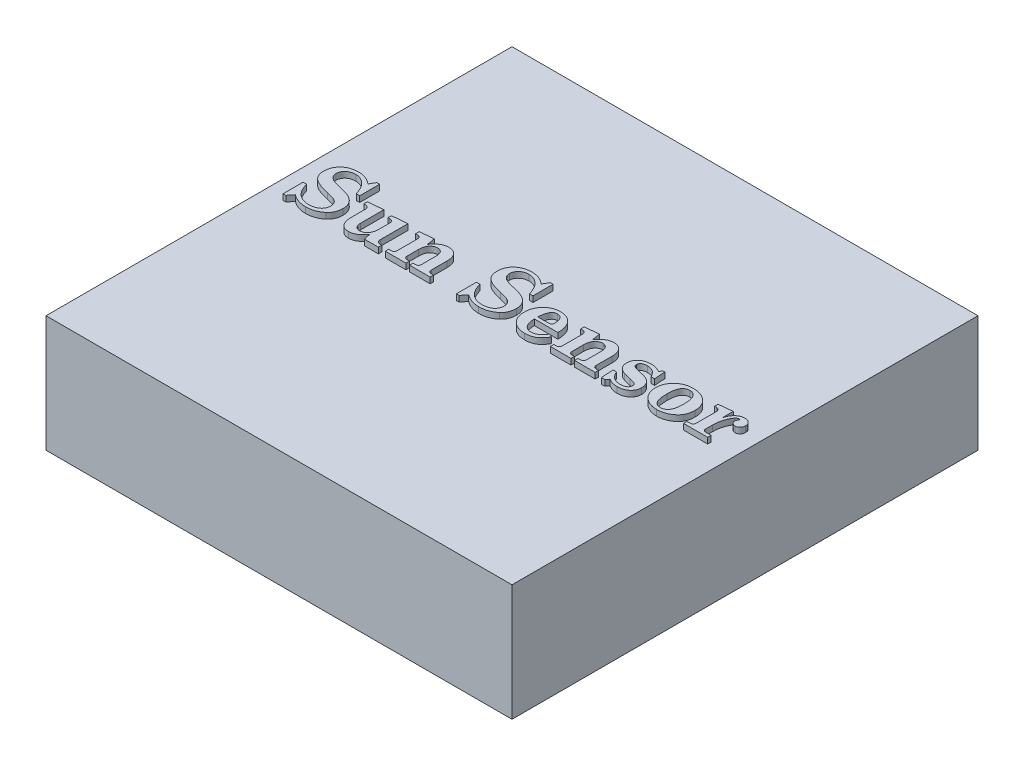
from build123d import *

# Parameters (mm, degrees)
SKETCH1_W           = 80
SKETCH1_H           = 80
BOSS_EXTRUDE1_DEPTH = 20
BOSS_EXTRUDE2_DEPTH = 1


with BuildPart() as part:
    # Sketch1 → Boss-Extrude1 (new body)
    with BuildSketch(Plane(origin=(0, 0, 0), x_dir=(1, 0, 0), z_dir=(0, 1, 0))):
        Rectangle(SKETCH1_W, SKETCH1_H)
    extrude(amount=BOSS_EXTRUDE1_DEPTH)

    # Sketch3 → Boss-Extrude2 (add)
    # profile 1 of 9: a face of its own
    with BuildSketch(Plane(origin=(0, 20, 0), x_dir=(1, 0, 0), z_dir=(0, 1, 0))):
        with BuildLine():
            Line((-30.955542102, 6.225516857), (-30.386931162, 7.20530574))
            Line((-30.386931162, 7.20530574), (-29.91278002, 7.20530574))
            Line((-29.91278002, 7.20530574), (-29.91278002, 3.767709961))
            Line((-29.91278002, 3.767709961), (-30.505468948, 3.767709961))
            add(Edge.make_bspline(
                [(-30.505468948, 3.767709961), (-30.541427462, 3.882899969), (-30.611797897, 4.108325604), (-30.733110836, 4.432480108), (-30.869336675, 4.732746913), (-31.013077712, 5.011928147), (-31.168961697, 5.268197387), (-31.335451768, 5.503299832), (-31.51568351, 5.714141414), (-31.704580887, 5.904430374), (-31.902972008, 6.069974078), (-32.10471366, 6.216520562), (-32.314103258, 6.336853007), (-32.527306033, 6.438047516), (-32.746457041, 6.515880869), (-32.970294798, 6.571807351), (-33.199273758, 6.606339152), (-33.353960964, 6.610514075), (-33.431870526, 6.612616812)],
                knots=[0, 0, 0, 0, 1.319776028, 2.582787814, 3.782699321, 4.924401408, 6.015368239, 7.061002147, 8.071798736, 9.045905284, 9.99008261, 10.895199989, 11.76966991, 12.627609111, 13.473423528, 14.308713002, 15.148168534, 16, 16, 16, 16], degree=3))
            add(Edge.make_bspline(
                [(-33.431870526, 6.612616812), (-33.497352129, 6.6110295), (-33.625550889, 6.607921886), (-33.813626016, 6.588412283), (-33.991790548, 6.550513912), (-34.160904908, 6.500506791), (-34.321993181, 6.438288533), (-34.471710654, 6.357356022), (-34.61395279, 6.264901994), (-34.743816427, 6.157574155), (-34.86286552, 6.042085866), (-34.963947306, 5.917086566), (-35.052710702, 5.789317812), (-35.123438875, 5.654112095), (-35.17968321, 5.513402996), (-35.217581805, 5.366408517), (-35.243542166, 5.214542569), (-35.245820406, 5.111251082), (-35.246980366, 5.058660531)],
                knots=[0, 0, 0, 0, 1.179059863, 2.308343204, 3.398322431, 4.453397569, 5.481306975, 6.500646799, 7.511833234, 8.530869999, 9.529082904, 10.492593709, 11.420571073, 12.32549536, 13.233690467, 14.142293599, 15.054154357, 16, 16, 16, 16], degree=3))
            add(Edge.make_bspline(
                [(-35.246980366, 5.058660531), (-35.244181016, 4.996790785), (-35.238648849, 4.874521773), (-35.203861845, 4.694800144), (-35.13993748, 4.524803357), (-35.058412698, 4.359183816), (-34.942366996, 4.206986615), (-34.800484778, 4.063642213), (-34.624827375, 3.938040398), (-34.460009862, 3.837581799), (-34.304672168, 3.766496014), (-34.166507743, 3.708573476), (-34.008117601, 3.649214777), (-33.828043125, 3.593413487), (-33.629368093, 3.533689644), (-33.410409687, 3.472195387), (-33.170629301, 3.411758347), (-33.003471622, 3.372923632), (-32.91697202, 3.352827712)],
                knots=[0, 0, 0, 0, 0.942679781, 1.862954546, 2.77322944, 3.702683276, 4.663757636, 5.6744788, 6.763451916, 7.943992375, 8.608674477, 9.363148904, 10.226045617, 11.183663279, 12.233902495, 13.386125419, 14.647390233, 16, 16, 16, 16], degree=3))
            add(Edge.make_bspline(
                [(-32.91697202, 3.352827712), (-32.815673968, 3.328951209), (-32.620225976, 3.282883051), (-32.339099954, 3.213196226), (-32.080987324, 3.143126234), (-31.84460814, 3.081003928), (-31.632578696, 3.01398997), (-31.442311881, 2.95444346), (-31.274775786, 2.895387051), (-31.172107941, 2.853715546), (-31.124088015, 2.834224901)],
                knots=[0, 0, 0, 0, 1.337017139, 2.579687437, 3.72053628, 4.773019566, 5.718849226, 6.576684044, 7.334284974, 8, 8, 8, 8], degree=3))
            add(Edge.make_bspline(
                [(-31.124088015, 2.834224901), (-31.055889123, 2.803355148), (-30.922275957, 2.742876081), (-30.730148487, 2.643235987), (-30.55311441, 2.533187707), (-30.386491408, 2.418891681), (-30.235473031, 2.294817559), (-30.096526901, 2.163889295), (-29.971271811, 2.025916787), (-29.859080457, 1.880382005), (-29.760494405, 1.727097714), (-29.672945613, 1.566751427), (-29.601053464, 1.397043555), (-29.541166838, 1.220062956), (-29.495442887, 1.034743575), (-29.461511452, 0.841752807), (-29.443699319, 0.640374267), (-29.440342305, 0.503629538), (-29.438628878, 0.433834745)],
                knots=[0, 0, 0, 0, 1.14653782, 2.246261516, 3.311791084, 4.337468781, 5.33879562, 6.302025459, 7.259342286, 8.189897906, 9.113170072, 10.048231112, 10.984438999, 11.93236922, 12.907088183, 13.905150231, 14.930784337, 16, 16, 16, 16], degree=3))
            add(Edge.make_bspline(
                [(-29.438628878, 0.433834745), (-29.440638835, 0.329943835), (-29.444569206, 0.126790333), (-29.489325625, -0.168948049), (-29.556987216, -0.449218915), (-29.653581314, -0.713445908), (-29.778184446, -0.961710573), (-29.931641059, -1.191953932), (-30.110147861, -1.408650092), (-30.249442218, -1.535396533), (-30.320253658, -1.599829136)],
                knots=[0, 0, 0, 0, 1.087616632, 2.126780161, 3.126105745, 4.104252425, 5.067529187, 6.029110535, 6.998082019, 8, 8, 8, 8], degree=3))
            add(Edge.make_bspline(
                [(-30.320253658, -1.599829136), (-30.410217236, -1.67336125), (-30.588832182, -1.819352937), (-30.880732062, -2.003716905), (-31.185316279, -2.163422983), (-31.508312817, -2.290014873), (-31.8457695, -2.393991534), (-32.201089433, -2.462167002), (-32.570737666, -2.506348708), (-32.822380468, -2.511946738), (-32.950310773, -2.514792668)],
                knots=[0, 0, 0, 0, 0.978964361, 1.943649534, 2.905309704, 3.874955019, 4.86478111, 5.878630743, 6.921537144, 8, 8, 8, 8], degree=3))
            add(Edge.make_bspline(
                [(-32.950310773, -2.514792668), (-33.069606925, -2.511921178), (-33.305874615, -2.506234151), (-33.656302804, -2.461398751), (-33.999797568, -2.393175156), (-34.333734425, -2.288469071), (-34.661467499, -2.162217846), (-34.978933191, -2.00180835), (-35.291847975, -1.818547111), (-35.488379653, -1.673292405), (-35.587776499, -1.599829136)],
                knots=[0, 0, 0, 0, 1.006582518, 1.993550691, 2.977708554, 3.958494488, 4.943590011, 5.938682306, 6.957478621, 8, 8, 8, 8], degree=3))
            Line((-35.587776499, -1.599829136), (-36.313820435, -2.514792668))
            Line((-36.313820435, -2.514792668), (-36.787971577, -2.514792668))
            Line((-36.787971577, -2.514792668), (-36.787971577, 0.92280311))
            Line((-36.787971577, 0.92280311), (-36.195282649, 0.92280311))
            add(Edge.make_bspline(
                [(-36.195282649, 0.92280311), (-36.161419164, 0.807541836), (-36.095283388, 0.582435239), (-35.976097986, 0.25970609), (-35.844993321, -0.041199354), (-35.700556571, -0.319909126), (-35.543045579, -0.576445439), (-35.3725432, -0.810974581), (-35.188609925, -1.022358662), (-34.993591456, -1.213682925), (-34.783540141, -1.379842589), (-34.561798264, -1.526401955), (-34.326013289, -1.647996524), (-34.078191524, -1.74890283), (-33.817639297, -1.826718512), (-33.544269253, -1.881877333), (-33.258018129, -1.916041744), (-33.062771432, -1.920057404), (-32.963275843, -1.922103741)],
                knots=[0, 0, 0, 0, 1.231685107, 2.405495193, 3.525354633, 4.595781342, 5.62194636, 6.609716111, 7.565664147, 8.492486262, 9.407117973, 10.307971796, 11.214149599, 12.122977695, 13.04839309, 13.998283572, 14.979947126, 16, 16, 16, 16], degree=3))
            add(Edge.make_bspline(
                [(-32.963275843, -1.922103741), (-32.882343152, -1.920779079), (-32.725095007, -1.918205327), (-32.496074338, -1.895482366), (-32.281085018, -1.859149164), (-32.079603019, -1.807290851), (-31.892595861, -1.740532293), (-31.718012478, -1.661061643), (-31.558414801, -1.56454525), (-31.413965122, -1.452935302), (-31.284740631, -1.330937843), (-31.170716467, -1.201454423), (-31.075589419, -1.063084772), (-30.997889649, -0.918191611), (-30.934904165, -0.766660752), (-30.893690848, -0.606943574), (-30.866371394, -0.44007754), (-30.862870912, -0.326278189), (-30.861082304, -0.268131203)],
                knots=[0, 0, 0, 0, 1.293831505, 2.513849511, 3.675894659, 4.777316931, 5.835830258, 6.847310371, 7.83943162, 8.810906231, 9.760670304, 10.677276707, 11.564492177, 12.439039997, 13.302485202, 14.181312827, 15.070722477, 16, 16, 16, 16], degree=3))
            add(Edge.make_bspline(
                [(-30.861082304, -0.268131203), (-30.863697615, -0.188870171), (-30.868768489, -0.035189566), (-30.914254407, 0.184426565), (-30.986182234, 0.385532591), (-31.091976125, 0.565511693), (-31.228493057, 0.728158625), (-31.397386554, 0.872484125), (-31.597761357, 1.002129459), (-31.747824532, 1.069298305), (-31.826053964, 1.104314094)],
                knots=[0, 0, 0, 0, 1.057749482, 2.050889025, 2.982426971, 3.899058759, 4.824111711, 5.806369846, 6.856438707, 8, 8, 8, 8], degree=3))
            add(Edge.make_bspline(
                [(-31.826053964, 1.104314094), (-31.852538353, 1.114367966), (-31.913705812, 1.13758805), (-32.018767045, 1.172071474), (-32.149064762, 1.211010569), (-32.304769823, 1.25329621), (-32.485753363, 1.299321527), (-32.691653214, 1.348687991), (-32.921576736, 1.40515583), (-33.083610084, 1.442258062), (-33.168864815, 1.461779604)],
                knots=[0, 0, 0, 0, 0.488899624, 1.129146184, 1.907908525, 2.835958675, 3.913689345, 5.130992951, 6.490456269, 8, 8, 8, 8], degree=3))
            add(Edge.make_bspline(
                [(-33.168864815, 1.461779604), (-33.285015923, 1.489841634), (-33.510336444, 1.544278923), (-33.836678386, 1.628995548), (-34.139746651, 1.715985122), (-34.419563131, 1.80283328), (-34.67628503, 1.889450265), (-34.909014566, 1.978240612), (-35.11963475, 2.06667012), (-35.363552213, 2.184993554), (-35.634860832, 2.342058465), (-35.918250858, 2.55449216), (-36.155190541, 2.788670789), (-36.349407151, 3.043185931), (-36.492362826, 3.327365296), (-36.597450283, 3.636160542), (-36.658542837, 3.97461048), (-36.665725876, 4.209508878), (-36.669433791, 4.330764442)],
                knots=[0, 0, 0, 0, 1.15334182, 2.237357742, 3.253976117, 4.196366833, 5.065095743, 5.868568384, 6.600168899, 7.269119258, 8.484304555, 9.620101968, 10.677738208, 11.690769999, 12.695512897, 13.733835216, 14.830195993, 16, 16, 16, 16], degree=3))
            add(Edge.make_bspline(
                [(-36.669433791, 4.330764442), (-36.667278271, 4.43464099), (-36.663065054, 4.637679849), (-36.620221597, 4.934580954), (-36.554963259, 5.217437555), (-36.459390719, 5.485293642), (-36.33899815, 5.739324466), (-36.189393835, 5.977136465), (-36.014318607, 6.201132569), (-35.812750035, 6.407478333), (-35.588915114, 6.594580734), (-35.344842086, 6.758241577), (-35.082629815, 6.897929534), (-34.801304876, 7.011222035), (-34.501888403, 7.097365466), (-34.18484353, 7.160942374), (-33.849471714, 7.197667647), (-33.619644233, 7.202723366), (-33.502252336, 7.20530574)],
                knots=[0, 0, 0, 0, 1.035008797, 2.023045706, 2.98455394, 3.924884624, 4.852721898, 5.781844619, 6.720138272, 7.682138956, 8.652316847, 9.623724157, 10.606782453, 11.609229013, 12.641617044, 13.708762662, 14.829675657, 16, 16, 16, 16], degree=3))
            add(Edge.make_bspline(
                [(-33.502252336, 7.20530574), (-33.387255249, 7.202665108), (-33.158782425, 7.197418778), (-32.820972179, 7.14900843), (-32.490357713, 7.073233076), (-32.167202197, 6.965331519), (-31.851507403, 6.825412532), (-31.543377399, 6.655722196), (-31.241072191, 6.457786105), (-31.051789235, 6.303810704), (-30.955542102, 6.225516857)],
                knots=[0, 0, 0, 0, 0.989559008, 1.966026685, 2.931744359, 3.906633899, 4.894263871, 5.900484555, 6.93243245, 8, 8, 8, 8], degree=3))
        make_face()
    # profile 2 of 9: a face of its own
    with BuildSketch(Plane(origin=(0, 20, 0), x_dir=(1, 0, 0), z_dir=(0, 1, 0))):
        with BuildLine():
            Line((-28.371788809, 3.53063439), (-25.763957529, 3.767709961))
            Line((-25.763957529, 3.767709961), (-25.763957529, -0.240348909))
            add(Edge.make_bspline(
                [(-25.763957529, -0.240348909), (-25.760645389, -0.328947922), (-25.754323334, -0.498061501), (-25.69992334, -0.737782745), (-25.610016197, -0.949640574), (-25.479430345, -1.126415616), (-25.324363284, -1.272749901), (-25.139968964, -1.372613601), (-24.93606822, -1.437922365), (-24.792110838, -1.444528393), (-24.717491142, -1.447952599)],
                knots=[0, 0, 0, 0, 1.18137524, 2.254952836, 3.262442219, 4.230077412, 5.169180991, 6.084107018, 7.006905032, 8, 8, 8, 8], degree=3))
            add(Edge.make_bspline(
                [(-24.717491142, -1.447952599), (-24.664264697, -1.446942131), (-24.559608693, -1.444955308), (-24.4071018, -1.416992728), (-24.261811001, -1.377422214), (-24.125418382, -1.319425798), (-23.998128365, -1.244268259), (-23.879010982, -1.152595894), (-23.767238979, -1.044929217), (-23.666872141, -0.920396476), (-23.574809191, -0.786819791), (-23.495327199, -0.645003529), (-23.425667182, -0.498261731), (-23.370733702, -0.344830602), (-23.328158891, -0.186120932), (-23.296157533, -0.022242809), (-23.277473466, 0.147545606), (-23.275605537, 0.262774142), (-23.274664035, 0.320853419)],
                knots=[0, 0, 0, 0, 1.001933379, 1.970042221, 2.913207299, 3.836196166, 4.754329873, 5.692383297, 6.663565065, 7.672368925, 8.702101108, 9.71832889, 10.733556612, 11.760654868, 12.785442884, 13.828504642, 14.905489182, 16, 16, 16, 16], degree=3))
            Line((-23.274664035, 0.320853419), (-23.274664035, 2.245240279))
            add(Edge.make_bspline(
                [(-23.274664035, 2.245240279), (-23.276651248, 2.298492262), (-23.28043881, 2.399988748), (-23.312677536, 2.542961558), (-23.371443472, 2.66447699), (-23.450827722, 2.765371413), (-23.550242523, 2.844597454), (-23.668882387, 2.89800808), (-23.802437529, 2.932554409), (-23.897370623, 2.936094783), (-23.946995537, 2.937945463)],
                knots=[0, 0, 0, 0, 1.163827328, 2.218215724, 3.178239915, 4.091167439, 5.004094963, 5.92813438, 6.916961942, 8, 8, 8, 8], degree=3))
            Line((-23.946995537, 2.937945463), (-24.222966318, 2.937945463))
            Line((-24.222966318, 2.937945463), (-24.222966318, 3.53063439))
            Line((-24.222966318, 3.53063439), (-21.615135038, 3.767709961))
            Line((-21.615135038, 3.767709961), (-21.615135038, -0.999731598))
            add(Edge.make_bspline(
                [(-21.615135038, -0.999731598), (-21.613724186, -1.050697698), (-21.611031059, -1.1479851), (-21.570687741, -1.283943818), (-21.515128091, -1.406385714), (-21.429204439, -1.506262054), (-21.326753035, -1.588177074), (-21.204749872, -1.642715258), (-21.069718519, -1.68004698), (-20.973949511, -1.683327061), (-20.924282007, -1.68502817)],
                knots=[0, 0, 0, 0, 1.108195048, 2.115394688, 3.073888545, 4.021325421, 4.962316745, 5.915012153, 6.918688368, 8, 8, 8, 8], degree=3))
            Line((-20.924282007, -1.68502817), (-20.666832755, -1.68502817))
            Line((-20.666832755, -1.68502817), (-20.666832755, -2.277717097))
            Line((-20.666832755, -2.277717097), (-23.037588464, -2.277717097))
            add(Edge.make_bspline(
                [(-23.037588464, -2.277717097), (-23.069296962, -2.185551072), (-23.13307356, -2.000173781), (-23.202857926, -1.711429751), (-23.251361795, -1.413495001), (-23.266855863, -1.211036664), (-23.274664035, -1.109008619)],
                knots=[0, 0, 0, 0, 0.976855681, 1.964789742, 2.974364164, 4, 4, 4, 4], degree=3))
            add(Edge.make_bspline(
                [(-23.274664035, -1.109008619), (-23.323619935, -1.171712705), (-23.418940303, -1.293801698), (-23.565314441, -1.466251979), (-23.710526819, -1.623768769), (-23.851752949, -1.769360743), (-23.995559902, -1.896878403), (-24.136359991, -2.011877184), (-24.274406228, -2.115313372), (-24.458624638, -2.226558124), (-24.689672868, -2.341838343), (-24.974759955, -2.440245857), (-25.265484361, -2.502901033), (-25.461746387, -2.510819555), (-25.560220711, -2.514792668)],
                knots=[0, 0, 0, 0, 1.027246358, 2.00011641, 2.919888438, 3.793731061, 4.618052012, 5.400030888, 6.141538373, 6.843003394, 8.176525732, 9.467469321, 10.729304648, 12, 12, 12, 12], degree=3))
            add(Edge.make_bspline(
                [(-25.560220711, -2.514792668), (-25.654236999, -2.511446532), (-25.836063255, -2.50497515), (-26.097838679, -2.4594627), (-26.335301214, -2.379010519), (-26.551493619, -2.268576732), (-26.745397913, -2.122070903), (-26.914540691, -1.936284102), (-27.066227117, -1.716908293), (-27.194646868, -1.460713005), (-27.298109303, -1.170998276), (-27.3707605, -0.850790437), (-27.415872421, -0.502169485), (-27.420886096, -0.260251288), (-27.423486526, -0.134776194)],
                knots=[0, 0, 0, 0, 0.987175969, 1.909185243, 2.778469296, 3.610673864, 4.448315432, 5.315348171, 6.237927114, 7.241131394, 8.315704986, 9.460576989, 10.682883946, 12, 12, 12, 12], degree=3))
            Line((-27.423486526, -0.134776194), (-27.423486526, 2.208197221))
            add(Edge.make_bspline(
                [(-27.423486526, 2.208197221), (-27.425760225, 2.267693154), (-27.430027682, 2.379359771), (-27.466650043, 2.533799142), (-27.527417617, 2.663221613), (-27.620360989, 2.766038788), (-27.749839091, 2.843227141), (-27.920105104, 2.89268549), (-28.131536554, 2.927342366), (-28.28703169, 2.934204861), (-28.371788809, 2.937945463)],
                knots=[0, 0, 0, 0, 1.029192065, 1.931668088, 2.730238053, 3.479695707, 4.295754938, 5.306791275, 6.531988714, 8, 8, 8, 8], degree=3))
            Line((-28.371788809, 2.937945463), (-28.371788809, 3.53063439))
        make_face()
    # profile 3 of 9: a face of its own
    with BuildSketch(Plane(origin=(0, 20, 0), x_dir=(1, 0, 0), z_dir=(0, 1, 0))):
        with BuildLine():
            Line((-11.776498845, -1.68502817), (-11.776498845, -2.277717097))
            Line((-11.776498845, -2.277717097), (-15.332632409, -2.277717097))
            Line((-15.332632409, -2.277717097), (-15.332632409, -1.68502817))
            Line((-15.332632409, -1.68502817), (-14.964053982, -1.68502817))
            add(Edge.make_bspline(
                [(-14.964053982, -1.68502817), (-14.918195117, -1.68352271), (-14.831692421, -1.680682991), (-14.711822227, -1.652761421), (-14.609040436, -1.60819593), (-14.525262828, -1.541820801), (-14.462314722, -1.455872496), (-14.413843635, -1.35526442), (-14.389774744, -1.236663871), (-14.386203238, -1.15292585), (-14.384330125, -1.109008619)],
                knots=[0, 0, 0, 0, 1.174903802, 2.216198411, 3.137837367, 4.028460015, 4.921895755, 5.850181395, 6.872506415, 8, 8, 8, 8], degree=3))
            Line((-14.384330125, -1.109008619), (-14.384330125, 1.382137029))
            add(Edge.make_bspline(
                [(-14.384330125, 1.382137029), (-14.38763095, 1.482412043), (-14.393879199, 1.672226259), (-14.446900724, 1.939293069), (-14.537317534, 2.17013361), (-14.664870137, 2.362188815), (-14.821178725, 2.515087939), (-15.005039008, 2.623133779), (-15.210655584, 2.691069951), (-15.3561732, 2.697547911), (-15.430796513, 2.700869892)],
                knots=[0, 0, 0, 0, 1.267262034, 2.39884632, 3.425349401, 4.382490926, 5.293591424, 6.165300778, 7.059142551, 8, 8, 8, 8], degree=3))
            add(Edge.make_bspline(
                [(-15.430796513, 2.700869892), (-15.482727232, 2.699465643), (-15.584612479, 2.696710582), (-15.734576781, 2.674370395), (-15.876314606, 2.634911971), (-16.012083992, 2.58361576), (-16.137759296, 2.513694949), (-16.25829857, 2.431592608), (-16.370891801, 2.333472364), (-16.474949892, 2.219584336), (-16.569360222, 2.092143432), (-16.651730923, 1.95001345), (-16.719084202, 1.793414791), (-16.777982744, 1.624339246), (-16.818785213, 1.440100032), (-16.850176119, 1.242826443), (-16.871655103, 1.031929585), (-16.872955473, 0.886432311), (-16.87362362, 0.811673936)],
                knots=[0, 0, 0, 0, 0.929965746, 1.824542218, 2.707145509, 3.561445169, 4.417532293, 5.276400433, 6.17001948, 7.085739905, 8.034581539, 9.005715936, 10.020750383, 11.083861864, 12.207809264, 13.394988504, 14.661511517, 16, 16, 16, 16], degree=3))
            Line((-16.87362362, 0.811673936), (-16.87362362, -1.109008619))
            add(Edge.make_bspline(
                [(-16.87362362, -1.109008619), (-16.871813808, -1.15295677), (-16.868362997, -1.236753747), (-16.843532138, -1.354700613), (-16.797976966, -1.456429504), (-16.734631763, -1.540642053), (-16.656279132, -1.60617919), (-16.565974199, -1.651294705), (-16.466685575, -1.680230106), (-16.396592869, -1.683399596), (-16.360577267, -1.68502817)],
                knots=[0, 0, 0, 0, 1.208840381, 2.304924458, 3.293058139, 4.250953789, 5.179491023, 6.07578188, 7.011282661, 8, 8, 8, 8], degree=3))
            Line((-16.360577267, -1.68502817), (-15.925321336, -1.68502817))
            Line((-15.925321336, -1.68502817), (-15.925321336, -2.277717097))
            Line((-15.925321336, -2.277717097), (-19.4814549, -2.277717097))
            Line((-19.4814549, -2.277717097), (-19.4814549, -1.68502817))
            Line((-19.4814549, -1.68502817), (-19.044346816, -1.68502817))
            add(Edge.make_bspline(
                [(-19.044346816, -1.68502817), (-19.004629017, -1.683497581), (-18.929042311, -1.680584728), (-18.823997333, -1.652199009), (-18.732560343, -1.607610063), (-18.659570302, -1.540285471), (-18.600795325, -1.457215317), (-18.56005431, -1.35589456), (-18.536493039, -1.238517821), (-18.534302669, -1.154810976), (-18.533152616, -1.110860771)],
                knots=[0, 0, 0, 0, 1.083476484, 2.061957578, 2.952656204, 3.837096352, 4.745528365, 5.714060529, 6.799769499, 8, 8, 8, 8], degree=3))
            Line((-18.533152616, -1.110860771), (-18.533152616, 2.295248408))
            add(Edge.make_bspline(
                [(-18.533152616, 2.295248408), (-18.535887145, 2.341716356), (-18.541184802, 2.431739644), (-18.575164421, 2.561060161), (-18.641242676, 2.672113796), (-18.726889687, 2.768199517), (-18.833513011, 2.842995225), (-18.954846326, 2.901497977), (-19.093573061, 2.931301498), (-19.190551972, 2.93568162), (-19.240675023, 2.937945463)],
                knots=[0, 0, 0, 0, 1.037632866, 2.010226975, 2.948258861, 3.894347858, 4.861561722, 5.835228312, 6.881148894, 8, 8, 8, 8], degree=3))
            Line((-19.240675023, 2.937945463), (-19.4814549, 2.937945463))
            Line((-19.4814549, 2.937945463), (-19.4814549, 3.53063439))
            Line((-19.4814549, 3.53063439), (-17.110699191, 3.767709961))
            add(Edge.make_bspline(
                [(-17.110699191, 3.767709961), (-17.084799761, 3.664867613), (-17.030827871, 3.450554174), (-16.971117406, 3.111008863), (-16.91362013, 2.744542393), (-16.887254418, 2.48987961), (-16.87362362, 2.358221606)],
                knots=[0, 0, 0, 0, 0.889226395, 1.853061201, 2.890055022, 4, 4, 4, 4], degree=3))
            add(Edge.make_bspline(
                [(-16.87362362, 2.358221606), (-16.78969303, 2.470247182), (-16.627662193, 2.686516337), (-16.362100763, 2.975611668), (-16.086170752, 3.21867878), (-15.802383715, 3.418926631), (-15.50863832, 3.574736709), (-15.207671573, 3.687205557), (-14.897261862, 3.754604518), (-14.687788317, 3.763326461), (-14.582510486, 3.767709961)],
                knots=[0, 0, 0, 0, 1.200183079, 2.316993948, 3.360187236, 4.348917367, 5.289384474, 6.204245342, 7.097484332, 8, 8, 8, 8], degree=3))
            add(Edge.make_bspline(
                [(-14.582510486, 3.767709961), (-14.512685461, 3.765757044), (-14.375632425, 3.761923844), (-14.175377425, 3.737045082), (-13.987069504, 3.689679914), (-13.810180653, 3.626638617), (-13.643136999, 3.547234243), (-13.489839185, 3.446296076), (-13.346535559, 3.32857464), (-13.262166172, 3.23778874), (-13.219325953, 3.19169041)],
                knots=[0, 0, 0, 0, 1.096329169, 2.151882403, 3.160372894, 4.138359743, 5.09640291, 6.056160588, 7.012977224, 8, 8, 8, 8], degree=3))
            add(Edge.make_bspline(
                [(-13.219325953, 3.19169041), (-13.179204747, 3.141940777), (-13.098693088, 3.042107648), (-12.999001828, 2.874570269), (-12.913378886, 2.694971957), (-12.845080619, 2.500400203), (-12.791424664, 2.292169407), (-12.7532279, 2.069167784), (-12.728282263, 1.832159106), (-12.725980132, 1.669286645), (-12.724801129, 1.585873848)],
                knots=[0, 0, 0, 0, 0.892898929, 1.791789977, 2.718775573, 3.671934425, 4.670925726, 5.722849091, 6.833789787, 8, 8, 8, 8], degree=3))
            Line((-12.724801129, 1.585873848), (-12.724801129, -1.10345216))
            add(Edge.make_bspline(
                [(-12.724801129, -1.10345216), (-12.723365518, -1.15178485), (-12.720686733, -1.24197145), (-12.692685213, -1.366106361), (-12.648859571, -1.470695663), (-12.5816774, -1.553986595), (-12.492051241, -1.614122998), (-12.383650157, -1.65730299), (-12.25337809, -1.679547034), (-12.159967378, -1.683115162), (-12.109886367, -1.68502817)],
                knots=[0, 0, 0, 0, 1.181448481, 2.204529132, 3.097766418, 3.935839047, 4.782860772, 5.711957012, 6.77329372, 8, 8, 8, 8], degree=3))
            Line((-12.109886367, -1.68502817), (-11.776498845, -1.68502817))
        make_face()
    # profile 4 of 9: a face of its own
    with BuildSketch(Plane(origin=(0, 20, 0), x_dir=(1, 0, 0), z_dir=(0, 1, 0))):
        with BuildLine():
            Line((-1.202557952, 6.225516857), (-0.633947012, 7.20530574))
            Line((-0.633947012, 7.20530574), (-0.159795871, 7.20530574))
            Line((-0.159795871, 7.20530574), (-0.159795871, 3.767709961))
            Line((-0.159795871, 3.767709961), (-0.752484798, 3.767709961))
            add(Edge.make_bspline(
                [(-0.752484798, 3.767709961), (-0.788443312, 3.882899969), (-0.858813747, 4.108325604), (-0.980126686, 4.432480108), (-1.116352525, 4.732746913), (-1.260093563, 5.011928147), (-1.415977548, 5.268197387), (-1.582467619, 5.503299832), (-1.762699361, 5.714141414), (-1.951596737, 5.904430374), (-2.149987859, 6.069974078), (-2.351729511, 6.216520562), (-2.561119108, 6.336853007), (-2.774321884, 6.438047516), (-2.993472891, 6.515880869), (-3.217310648, 6.571807351), (-3.446289608, 6.606339152), (-3.600976814, 6.610514075), (-3.678886376, 6.612616812)],
                knots=[0, 0, 0, 0, 1.319776028, 2.582787814, 3.782699321, 4.924401408, 6.015368239, 7.061002147, 8.071798736, 9.045905284, 9.99008261, 10.895199989, 11.76966991, 12.627609111, 13.473423528, 14.308713002, 15.148168534, 16, 16, 16, 16], degree=3))
            add(Edge.make_bspline(
                [(-3.678886376, 6.612616812), (-3.744367979, 6.6110295), (-3.872566739, 6.607921886), (-4.060641866, 6.588412283), (-4.238806399, 6.550513912), (-4.407920758, 6.500506791), (-4.569009031, 6.438288533), (-4.718726504, 6.357356022), (-4.860968641, 6.264901994), (-4.990832278, 6.157574155), (-5.10988137, 6.042085866), (-5.210963156, 5.917086566), (-5.299726553, 5.789317812), (-5.370454725, 5.654112095), (-5.42669906, 5.513402996), (-5.464597655, 5.366408517), (-5.490558016, 5.214542569), (-5.492836257, 5.111251082), (-5.493996216, 5.058660531)],
                knots=[0, 0, 0, 0, 1.179059863, 2.308343204, 3.398322431, 4.453397569, 5.481306975, 6.500646799, 7.511833234, 8.530869999, 9.529082904, 10.492593709, 11.420571073, 12.32549536, 13.233690467, 14.142293599, 15.054154357, 16, 16, 16, 16], degree=3))
            add(Edge.make_bspline(
                [(-5.493996216, 5.058660531), (-5.491196866, 4.996790785), (-5.485664699, 4.874521773), (-5.450877695, 4.694800144), (-5.38695333, 4.524803357), (-5.305428548, 4.359183816), (-5.189382846, 4.206986615), (-5.047500628, 4.063642213), (-4.871843226, 3.938040398), (-4.707025712, 3.837581799), (-4.551688018, 3.766496014), (-4.413523594, 3.708573476), (-4.255133451, 3.649214777), (-4.075058975, 3.593413487), (-3.876383943, 3.533689644), (-3.657425537, 3.472195387), (-3.417645152, 3.411758347), (-3.250487472, 3.372923632), (-3.163987871, 3.352827712)],
                knots=[0, 0, 0, 0, 0.942679781, 1.862954546, 2.77322944, 3.702683276, 4.663757636, 5.6744788, 6.763451916, 7.943992375, 8.608674477, 9.363148904, 10.226045617, 11.183663279, 12.233902495, 13.386125419, 14.647390233, 16, 16, 16, 16], degree=3))
            add(Edge.make_bspline(
                [(-3.163987871, 3.352827712), (-3.062689818, 3.328951209), (-2.867241827, 3.282883051), (-2.586115804, 3.213196226), (-2.328003174, 3.143126234), (-2.09162399, 3.081003928), (-1.879594546, 3.01398997), (-1.689327732, 2.95444346), (-1.521791636, 2.895387051), (-1.419123792, 2.853715546), (-1.371103866, 2.834224901)],
                knots=[0, 0, 0, 0, 1.337017139, 2.579687437, 3.72053628, 4.773019566, 5.718849226, 6.576684044, 7.334284974, 8, 8, 8, 8], degree=3))
            add(Edge.make_bspline(
                [(-1.371103866, 2.834224901), (-1.302904973, 2.803355148), (-1.169291807, 2.742876081), (-0.977164337, 2.643235987), (-0.80013026, 2.533187707), (-0.633507258, 2.418891681), (-0.482488881, 2.294817559), (-0.343542751, 2.163889295), (-0.218287662, 2.025916787), (-0.106096307, 1.880382005), (-0.007510256, 1.727097714), (0.080038537, 1.566751427), (0.151930686, 1.397043555), (0.211817312, 1.220062956), (0.257541263, 1.034743575), (0.291472698, 0.841752807), (0.309284831, 0.640374267), (0.312641844, 0.503629538), (0.314355271, 0.433834745)],
                knots=[0, 0, 0, 0, 1.14653782, 2.246261516, 3.311791084, 4.337468781, 5.33879562, 6.302025459, 7.259342286, 8.189897906, 9.113170072, 10.048231112, 10.984438999, 11.93236922, 12.907088183, 13.905150231, 14.930784337, 16, 16, 16, 16], degree=3))
            add(Edge.make_bspline(
                [(0.314355271, 0.433834745), (0.312345314, 0.329943835), (0.308414944, 0.126790333), (0.263658525, -0.168948049), (0.195996934, -0.449218915), (0.099402835, -0.713445908), (-0.025200296, -0.961710573), (-0.178656909, -1.191953932), (-0.357163711, -1.408650092), (-0.496458068, -1.535396533), (-0.567269508, -1.599829136)],
                knots=[0, 0, 0, 0, 1.087616632, 2.126780161, 3.126105745, 4.104252425, 5.067529187, 6.029110535, 6.998082019, 8, 8, 8, 8], degree=3))
            add(Edge.make_bspline(
                [(-0.567269508, -1.599829136), (-0.657233086, -1.67336125), (-0.835848032, -1.819352937), (-1.127747913, -2.003716905), (-1.432332129, -2.163422983), (-1.755328667, -2.290014873), (-2.09278535, -2.393991534), (-2.448105283, -2.462167002), (-2.817753517, -2.506348708), (-3.069396319, -2.511946738), (-3.197326623, -2.514792668)],
                knots=[0, 0, 0, 0, 0.978964361, 1.943649534, 2.905309704, 3.874955019, 4.86478111, 5.878630743, 6.921537144, 8, 8, 8, 8], degree=3))
            add(Edge.make_bspline(
                [(-3.197326623, -2.514792668), (-3.316622775, -2.511921178), (-3.552890465, -2.506234151), (-3.903318654, -2.461398751), (-4.246813418, -2.393175156), (-4.580750275, -2.288469071), (-4.908483349, -2.162217846), (-5.225949041, -2.00180835), (-5.538863825, -1.818547111), (-5.735395504, -1.673292405), (-5.834792349, -1.599829136)],
                knots=[0, 0, 0, 0, 1.006582518, 1.993550691, 2.977708554, 3.958494488, 4.943590011, 5.938682306, 6.957478621, 8, 8, 8, 8], degree=3))
            Line((-5.834792349, -1.599829136), (-6.560836285, -2.514792668))
            Line((-6.560836285, -2.514792668), (-7.034987427, -2.514792668))
            Line((-7.034987427, -2.514792668), (-7.034987427, 0.92280311))
            Line((-7.034987427, 0.92280311), (-6.4422985, 0.92280311))
            add(Edge.make_bspline(
                [(-6.4422985, 0.92280311), (-6.408435015, 0.807541836), (-6.342299238, 0.582435239), (-6.223113836, 0.25970609), (-6.092009172, -0.041199354), (-5.947572421, -0.319909126), (-5.790061429, -0.576445439), (-5.61955905, -0.810974581), (-5.435625775, -1.022358662), (-5.240607307, -1.213682925), (-5.030555991, -1.379842589), (-4.808814114, -1.526401955), (-4.57302914, -1.647996524), (-4.325207374, -1.74890283), (-4.064655148, -1.826718512), (-3.791285103, -1.881877333), (-3.505033979, -1.916041744), (-3.309787282, -1.920057404), (-3.210291693, -1.922103741)],
                knots=[0, 0, 0, 0, 1.231685107, 2.405495193, 3.525354633, 4.595781342, 5.62194636, 6.609716111, 7.565664147, 8.492486262, 9.407117973, 10.307971796, 11.214149599, 12.122977695, 13.04839309, 13.998283572, 14.979947126, 16, 16, 16, 16], degree=3))
            add(Edge.make_bspline(
                [(-3.210291693, -1.922103741), (-3.129359003, -1.920779079), (-2.972110857, -1.918205327), (-2.743090188, -1.895482366), (-2.528100868, -1.859149164), (-2.326618869, -1.807290851), (-2.139611712, -1.740532293), (-1.965028328, -1.661061643), (-1.805430652, -1.56454525), (-1.660980972, -1.452935302), (-1.531756481, -1.330937843), (-1.417732318, -1.201454423), (-1.322605269, -1.063084772), (-1.244905499, -0.918191611), (-1.181920016, -0.766660752), (-1.140706698, -0.606943574), (-1.113387245, -0.44007754), (-1.109886763, -0.326278189), (-1.108098154, -0.268131203)],
                knots=[0, 0, 0, 0, 1.293831505, 2.513849511, 3.675894659, 4.777316931, 5.835830258, 6.847310371, 7.83943162, 8.810906231, 9.760670304, 10.677276707, 11.564492177, 12.439039997, 13.302485202, 14.181312827, 15.070722477, 16, 16, 16, 16], degree=3))
            add(Edge.make_bspline(
                [(-1.108098154, -0.268131203), (-1.110713466, -0.188870171), (-1.115784339, -0.035189566), (-1.161270258, 0.184426565), (-1.233198084, 0.385532591), (-1.338991975, 0.565511693), (-1.475508907, 0.728158625), (-1.644402404, 0.872484125), (-1.844777207, 1.002129459), (-1.994840383, 1.069298305), (-2.073069814, 1.104314094)],
                knots=[0, 0, 0, 0, 1.057749482, 2.050889025, 2.982426971, 3.899058759, 4.824111711, 5.806369846, 6.856438707, 8, 8, 8, 8], degree=3))
            add(Edge.make_bspline(
                [(-2.073069814, 1.104314094), (-2.099554204, 1.114367966), (-2.160721662, 1.13758805), (-2.265782895, 1.172071474), (-2.396080612, 1.211010569), (-2.551785673, 1.25329621), (-2.732769213, 1.299321527), (-2.938669065, 1.348687991), (-3.168592586, 1.40515583), (-3.330625934, 1.442258062), (-3.415880665, 1.461779604)],
                knots=[0, 0, 0, 0, 0.488899624, 1.129146184, 1.907908525, 2.835958675, 3.913689345, 5.130992951, 6.490456269, 8, 8, 8, 8], degree=3))
            add(Edge.make_bspline(
                [(-3.415880665, 1.461779604), (-3.532031773, 1.489841634), (-3.757352295, 1.544278923), (-4.083694237, 1.628995548), (-4.386762501, 1.715985122), (-4.666578982, 1.80283328), (-4.923300881, 1.889450265), (-5.156030416, 1.978240612), (-5.3666506, 2.06667012), (-5.610568063, 2.184993554), (-5.881876683, 2.342058465), (-6.165266709, 2.55449216), (-6.402206392, 2.788670789), (-6.596423001, 3.043185931), (-6.739378676, 3.327365296), (-6.844466133, 3.636160542), (-6.905558687, 3.97461048), (-6.912741726, 4.209508878), (-6.916449642, 4.330764442)],
                knots=[0, 0, 0, 0, 1.15334182, 2.237357742, 3.253976117, 4.196366833, 5.065095743, 5.868568384, 6.600168899, 7.269119258, 8.484304555, 9.620101968, 10.677738208, 11.690769999, 12.695512897, 13.733835216, 14.830195993, 16, 16, 16, 16], degree=3))
            add(Edge.make_bspline(
                [(-6.916449642, 4.330764442), (-6.914294121, 4.43464099), (-6.910080904, 4.637679849), (-6.867237447, 4.934580954), (-6.801979109, 5.217437555), (-6.706406569, 5.485293642), (-6.586014, 5.739324466), (-6.436409686, 5.977136465), (-6.261334458, 6.201132569), (-6.059765885, 6.407478333), (-5.835930965, 6.594580734), (-5.591857936, 6.758241577), (-5.329645666, 6.897929534), (-5.048320727, 7.011222035), (-4.748904253, 7.097365466), (-4.43185938, 7.160942374), (-4.096487565, 7.197667647), (-3.866660083, 7.202723366), (-3.749268187, 7.20530574)],
                knots=[0, 0, 0, 0, 1.035008797, 2.023045706, 2.98455394, 3.924884624, 4.852721898, 5.781844619, 6.720138272, 7.682138956, 8.652316847, 9.623724157, 10.606782453, 11.609229013, 12.641617044, 13.708762662, 14.829675657, 16, 16, 16, 16], degree=3))
            add(Edge.make_bspline(
                [(-3.749268187, 7.20530574), (-3.6342711, 7.202665108), (-3.405798276, 7.197418778), (-3.067988029, 7.14900843), (-2.737373564, 7.073233076), (-2.414218047, 6.965331519), (-2.098523254, 6.825412532), (-1.790393249, 6.655722196), (-1.488088041, 6.457786105), (-1.298805085, 6.303810704), (-1.202557952, 6.225516857)],
                knots=[0, 0, 0, 0, 0.989559008, 1.966026685, 2.931744359, 3.906633899, 4.894263871, 5.900484555, 6.93243245, 8, 8, 8, 8], degree=3))
        make_face()
    # profile 5 of 9: a face of its own
    with BuildSketch(Plane(origin=(0, 20, 0), x_dir=(1, 0, 0), z_dir=(0, 1, 0))):
        with BuildLine():
            Line((7.426622399, 0.448651968), (3.396337693, 0.448651968))
            add(Edge.make_bspline(
                [(3.396337693, 0.448651968), (3.398812775, 0.355355627), (3.40359226, 0.175196487), (3.430547557, -0.085710156), (3.468456942, -0.327726552), (3.519734271, -0.551616061), (3.585994607, -0.755641206), (3.666535071, -0.940763087), (3.757763951, -1.108731196), (3.866379213, -1.255673229), (3.985617416, -1.38358868), (4.111929053, -1.495629221), (4.246351641, -1.591238969), (4.389143829, -1.669448378), (4.541144344, -1.729156665), (4.700895656, -1.771362424), (4.868529074, -1.798089814), (4.98291469, -1.801720642), (5.041049466, -1.803565955)],
                knots=[0, 0, 0, 0, 1.426981041, 2.75556009, 4.008354149, 5.171922164, 6.264836811, 7.284042032, 8.256233062, 9.181671133, 10.070344161, 10.926672325, 11.759831508, 12.58805309, 13.410440531, 14.25105781, 15.111126323, 16, 16, 16, 16], degree=3))
            add(Edge.make_bspline(
                [(5.041049466, -1.803565955), (5.125248153, -1.79967601), (5.293366606, -1.791909006), (5.542249099, -1.739091192), (5.782344647, -1.647970926), (6.020881502, -1.523803819), (6.255314533, -1.348731767), (6.489525085, -1.118470204), (6.725752356, -0.831554153), (6.873990582, -0.61454165), (6.952471257, -0.499650315)],
                knots=[0, 0, 0, 0, 0.834426279, 1.666088397, 2.508308317, 3.373249975, 4.322952495, 5.396129529, 6.62145198, 8, 8, 8, 8], degree=3))
            Line((6.952471257, -0.499650315), (7.545160184, -0.736725886))
            add(Edge.make_bspline(
                [(7.545160184, -0.736725886), (7.501437009, -0.813714058), (7.415592638, -0.964869624), (7.277254923, -1.179347223), (7.132949907, -1.375924146), (6.983470492, -1.554337762), (6.832139043, -1.719042785), (6.673170289, -1.864790025), (6.509435524, -1.993215763), (6.341296922, -2.105830965), (6.16573169, -2.202616572), (5.981791148, -2.28611147), (5.788598311, -2.356704895), (5.58530122, -2.413591076), (5.373440659, -2.460730397), (5.150967413, -2.490677662), (4.920487542, -2.512765072), (4.763283084, -2.514110544), (4.683583957, -2.514792668)],
                knots=[0, 0, 0, 0, 1.190077197, 2.336551023, 3.428839929, 4.466006424, 5.464321958, 6.433543367, 7.361666135, 8.2594184, 9.151011057, 10.053584428, 10.972570255, 11.913115975, 12.889877323, 13.887571648, 14.929046295, 16, 16, 16, 16], degree=3))
            add(Edge.make_bspline(
                [(4.683583957, -2.514792668), (4.5673927, -2.512564007), (4.340430261, -2.508210649), (4.008690321, -2.466570408), (3.694500456, -2.397986194), (3.396270773, -2.303859052), (3.114882342, -2.181154024), (2.851055889, -2.029958971), (2.602873113, -1.853877694), (2.376473671, -1.649860588), (2.170875145, -1.426206454), (1.990206734, -1.185550301), (1.839334438, -0.927088396), (1.715233951, -0.65469139), (1.61767596, -0.366865589), (1.550756509, -0.063726151), (1.505652692, 0.254677411), (1.501734446, 0.472567528), (1.499733126, 0.58385913)],
                knots=[0, 0, 0, 0, 1.116716421, 2.181340401, 3.208262672, 4.205082042, 5.183276302, 6.15365906, 7.123842093, 8.103332214, 9.0780082, 10.040808872, 10.990640451, 11.949572487, 12.914402091, 13.906562449, 14.930736178, 16, 16, 16, 16], degree=3))
            add(Edge.make_bspline(
                [(1.499733126, 0.58385913), (1.501776631, 0.695142752), (1.505788711, 0.913629538), (1.550576567, 1.233342878), (1.618714412, 1.539758942), (1.714198494, 1.832591021), (1.840362894, 2.110198736), (1.98979282, 2.375491759), (2.171791294, 2.623700379), (2.375894858, 2.857742638), (2.599715119, 3.071226857), (2.839484557, 3.258148175), (3.093432055, 3.41342818), (3.357554188, 3.545608247), (3.636337924, 3.645203019), (3.926999667, 3.715126786), (4.229693293, 3.75931087), (4.435858651, 3.764873804), (4.540968184, 3.767709961)],
                knots=[0, 0, 0, 0, 1.086548139, 2.133255613, 3.147336993, 4.150651743, 5.136074529, 6.122143222, 7.119949058, 8.137343706, 9.152769606, 10.137287411, 11.101473281, 12.056407607, 13.018024124, 13.986502147, 14.973455967, 16, 16, 16, 16], degree=3))
            add(Edge.make_bspline(
                [(4.540968184, 3.767709961), (4.613252331, 3.766880233), (4.756214407, 3.765239213), (4.966261624, 3.74511721), (5.169403446, 3.718602658), (5.364002844, 3.678295643), (5.549949561, 3.622754586), (5.729974868, 3.561744742), (5.900836913, 3.484547833), (6.064249091, 3.397415776), (6.219820589, 3.300086523), (6.36527853, 3.189443163), (6.501782258, 3.068521294), (6.633273953, 2.939798904), (6.75038859, 2.795418591), (6.862743629, 2.643822766), (6.964508767, 2.48011506), (7.057055518, 2.305516184), (7.141242357, 2.119768327), (7.213042009, 1.920054623), (7.276048609, 1.707450379), (7.327725692, 1.480997195), (7.367693954, 1.24152688), (7.399461616, 0.989499081), (7.4200183, 0.723707417), (7.424383188, 0.541913319), (7.426622399, 0.448651968)],
                knots=[0, 0, 0, 0, 1.04272512, 2.062279955, 3.042540651, 3.998325299, 4.925957738, 5.841705795, 6.739066981, 7.627896066, 8.512787111, 9.384119268, 10.261624082, 11.143595057, 12.035633243, 12.940876405, 13.865423299, 14.813997205, 15.790972986, 16.805611266, 17.874015987, 18.989203856, 20.155091086, 21.376178781, 22.653965592, 24, 24, 24, 24], degree=3))
        make_face()
        with BuildLine():
            Line((3.396337693, 1.041340896), (5.274420731, 1.041340896))
            add(Edge.make_bspline(
                [(5.274420731, 1.041340896), (5.315229379, 1.043345395), (5.392083571, 1.047120432), (5.499179789, 1.068612564), (5.586287435, 1.113428618), (5.658281775, 1.175085801), (5.707825607, 1.264306965), (5.745344094, 1.3763215), (5.762790918, 1.516224956), (5.76558421, 1.617959005), (5.767093402, 1.672925034)],
                knots=[0, 0, 0, 0, 1.052657941, 1.982451801, 2.786183488, 3.552211475, 4.386819608, 5.377588737, 6.583133818, 8, 8, 8, 8], degree=3))
            add(Edge.make_bspline(
                [(5.767093402, 1.672925034), (5.765957747, 1.730995505), (5.763743058, 1.844241173), (5.748594758, 2.008755901), (5.725656173, 2.163236505), (5.689616646, 2.306642072), (5.645859161, 2.441008255), (5.590246291, 2.564970465), (5.524908756, 2.679001668), (5.451038178, 2.782624799), (5.36975463, 2.875077144), (5.282350098, 2.956342526), (5.187102406, 3.022031655), (5.08876, 3.079192507), (4.983704847, 3.12137798), (4.874073841, 3.153412047), (4.758328213, 3.172350968), (4.679331294, 3.17412055), (4.639132287, 3.175021034)],
                knots=[0, 0, 0, 0, 1.321567116, 2.577243613, 3.75778477, 4.872247702, 5.938724832, 6.970284603, 7.958535828, 8.925579644, 9.861493924, 10.756644977, 11.633858883, 12.489651868, 13.340353556, 14.203155233, 15.085643131, 16, 16, 16, 16], degree=3))
            add(Edge.make_bspline(
                [(4.639132287, 3.175021034), (4.592061144, 3.17401042), (4.499623883, 3.1720258), (4.366123392, 3.144261881), (4.239409996, 3.104434861), (4.122971477, 3.043958393), (4.013910478, 2.969542027), (3.914473813, 2.876862914), (3.824543528, 2.767350188), (3.742247084, 2.642085438), (3.67017109, 2.499442168), (3.605909473, 2.340814586), (3.550364105, 2.164769909), (3.503179196, 1.972830961), (3.461752213, 1.764101964), (3.431026325, 1.538330628), (3.40911586, 1.295403886), (3.400686817, 1.127812715), (3.396337693, 1.041340896)],
                knots=[0, 0, 0, 0, 0.820895044, 1.612055359, 2.37270136, 3.134875378, 3.894832769, 4.673393004, 5.500641273, 6.365230705, 7.286625024, 8.28812785, 9.352426815, 10.508728518, 11.739882097, 13.068527489, 14.487451568, 16, 16, 16, 16], degree=3))
        make_face(mode=Mode.SUBTRACT)
    # profile 6 of 9: a face of its own
    with BuildSketch(Plane(origin=(0, 20, 0), x_dir=(1, 0, 0), z_dir=(0, 1, 0))):
        with BuildLine():
            Line((16.554031879, -1.68502817), (16.554031879, -2.277717097))
            Line((16.554031879, -2.277717097), (12.997898315, -2.277717097))
            Line((12.997898315, -2.277717097), (12.997898315, -1.68502817))
            Line((12.997898315, -1.68502817), (13.366476742, -1.68502817))
            add(Edge.make_bspline(
                [(13.366476742, -1.68502817), (13.412335607, -1.68352271), (13.498838303, -1.680682991), (13.618708497, -1.652761421), (13.721490288, -1.60819593), (13.805267897, -1.541820801), (13.868216002, -1.455872496), (13.91668709, -1.35526442), (13.94075598, -1.236663871), (13.944327487, -1.15292585), (13.946200599, -1.109008619)],
                knots=[0, 0, 0, 0, 1.174903802, 2.216198411, 3.137837367, 4.028460015, 4.921895755, 5.850181395, 6.872506415, 8, 8, 8, 8], degree=3))
            Line((13.946200599, -1.109008619), (13.946200599, 1.382137029))
            add(Edge.make_bspline(
                [(13.946200599, 1.382137029), (13.942899775, 1.482412043), (13.936651525, 1.672226259), (13.88363, 1.939293069), (13.79321319, 2.17013361), (13.665660587, 2.362188815), (13.509351999, 2.515087939), (13.325491716, 2.623133779), (13.11987514, 2.691069951), (12.974357524, 2.697547911), (12.899734211, 2.700869892)],
                knots=[0, 0, 0, 0, 1.267262034, 2.39884632, 3.425349401, 4.382490926, 5.293591424, 6.165300778, 7.059142551, 8, 8, 8, 8], degree=3))
            add(Edge.make_bspline(
                [(12.899734211, 2.700869892), (12.847803492, 2.699465643), (12.745918245, 2.696710582), (12.595953943, 2.674370395), (12.454216118, 2.634911971), (12.318446732, 2.58361576), (12.192771428, 2.513694949), (12.072232154, 2.431592608), (11.959638923, 2.333472364), (11.855580832, 2.219584336), (11.761170502, 2.092143432), (11.678799801, 1.95001345), (11.611446522, 1.793414791), (11.55254798, 1.624339246), (11.511745511, 1.440100032), (11.480354605, 1.242826443), (11.458875621, 1.031929585), (11.457575251, 0.886432311), (11.456907104, 0.811673936)],
                knots=[0, 0, 0, 0, 0.929965746, 1.824542218, 2.707145509, 3.561445169, 4.417532293, 5.276400433, 6.17001948, 7.085739905, 8.034581539, 9.005715936, 10.020750383, 11.083861864, 12.207809264, 13.394988504, 14.661511517, 16, 16, 16, 16], degree=3))
            Line((11.456907104, 0.811673936), (11.456907104, -1.109008619))
            add(Edge.make_bspline(
                [(11.456907104, -1.109008619), (11.458716916, -1.15295677), (11.462167727, -1.236753747), (11.486998586, -1.354700613), (11.532553759, -1.456429504), (11.595898961, -1.540642053), (11.674251592, -1.60617919), (11.764556525, -1.651294705), (11.863845149, -1.680230106), (11.933937855, -1.683399596), (11.969953457, -1.68502817)],
                knots=[0, 0, 0, 0, 1.208840381, 2.304924458, 3.293058139, 4.250953789, 5.179491023, 6.07578188, 7.011282661, 8, 8, 8, 8], degree=3))
            Line((11.969953457, -1.68502817), (12.405209388, -1.68502817))
            Line((12.405209388, -1.68502817), (12.405209388, -2.277717097))
            Line((12.405209388, -2.277717097), (8.849075824, -2.277717097))
            Line((8.849075824, -2.277717097), (8.849075824, -1.68502817))
            Line((8.849075824, -1.68502817), (9.286183908, -1.68502817))
            add(Edge.make_bspline(
                [(9.286183908, -1.68502817), (9.325901708, -1.683497581), (9.401488413, -1.680584728), (9.506533391, -1.652199009), (9.597970381, -1.607610063), (9.670960422, -1.540285471), (9.729735399, -1.457215317), (9.770476414, -1.35589456), (9.794037685, -1.238517821), (9.796228056, -1.154810976), (9.797378108, -1.110860771)],
                knots=[0, 0, 0, 0, 1.083476484, 2.061957578, 2.952656204, 3.837096352, 4.745528365, 5.714060529, 6.799769499, 8, 8, 8, 8], degree=3))
            Line((9.797378108, -1.110860771), (9.797378108, 2.295248408))
            add(Edge.make_bspline(
                [(9.797378108, 2.295248408), (9.794643579, 2.341716356), (9.789345922, 2.431739644), (9.755366303, 2.561060161), (9.689288048, 2.672113796), (9.603641038, 2.768199517), (9.497017713, 2.842995225), (9.375684398, 2.901497977), (9.236957663, 2.931301498), (9.139978752, 2.93568162), (9.089855701, 2.937945463)],
                knots=[0, 0, 0, 0, 1.037632866, 2.010226975, 2.948258861, 3.894347858, 4.861561722, 5.835228312, 6.881148894, 8, 8, 8, 8], degree=3))
            Line((9.089855701, 2.937945463), (8.849075824, 2.937945463))
            Line((8.849075824, 2.937945463), (8.849075824, 3.53063439))
            Line((8.849075824, 3.53063439), (11.219831533, 3.767709961))
            add(Edge.make_bspline(
                [(11.219831533, 3.767709961), (11.245730963, 3.664867613), (11.299702853, 3.450554174), (11.359413318, 3.111008863), (11.416910595, 2.744542393), (11.443276306, 2.48987961), (11.456907104, 2.358221606)],
                knots=[0, 0, 0, 0, 0.889226395, 1.853061201, 2.890055022, 4, 4, 4, 4], degree=3))
            add(Edge.make_bspline(
                [(11.456907104, 2.358221606), (11.540837694, 2.470247182), (11.702868531, 2.686516337), (11.968429961, 2.975611668), (12.244359972, 3.21867878), (12.528147009, 3.418926631), (12.821892404, 3.574736709), (13.122859151, 3.687205557), (13.433268862, 3.754604518), (13.642742407, 3.763326461), (13.748020239, 3.767709961)],
                knots=[0, 0, 0, 0, 1.200183079, 2.316993948, 3.360187236, 4.348917367, 5.289384474, 6.204245342, 7.097484332, 8, 8, 8, 8], degree=3))
            add(Edge.make_bspline(
                [(13.748020239, 3.767709961), (13.817845263, 3.765757044), (13.954898299, 3.761923844), (14.155153299, 3.737045082), (14.34346122, 3.689679914), (14.520350072, 3.626638617), (14.687393726, 3.547234243), (14.840691539, 3.446296076), (14.983995165, 3.32857464), (15.068364552, 3.23778874), (15.111204771, 3.19169041)],
                knots=[0, 0, 0, 0, 1.096329169, 2.151882403, 3.160372894, 4.138359743, 5.09640291, 6.056160588, 7.012977224, 8, 8, 8, 8], degree=3))
            add(Edge.make_bspline(
                [(15.111204771, 3.19169041), (15.151325977, 3.141940777), (15.231837636, 3.042107648), (15.331528896, 2.874570269), (15.417151839, 2.694971957), (15.485450105, 2.500400203), (15.53910606, 2.292169407), (15.577302824, 2.069167784), (15.602248461, 1.832159106), (15.604550592, 1.669286645), (15.605729595, 1.585873848)],
                knots=[0, 0, 0, 0, 0.892898929, 1.791789977, 2.718775573, 3.671934425, 4.670925726, 5.722849091, 6.833789787, 8, 8, 8, 8], degree=3))
            Line((15.605729595, 1.585873848), (15.605729595, -1.10345216))
            add(Edge.make_bspline(
                [(15.605729595, -1.10345216), (15.607165206, -1.15178485), (15.609843991, -1.24197145), (15.637845511, -1.366106361), (15.681671153, -1.470695663), (15.748853324, -1.553986595), (15.838479483, -1.614122998), (15.946880567, -1.65730299), (16.077152634, -1.679547034), (16.170563346, -1.683115162), (16.220644357, -1.68502817)],
                knots=[0, 0, 0, 0, 1.181448481, 2.204529132, 3.097766418, 3.935839047, 4.782860772, 5.711957012, 6.77329372, 8, 8, 8, 8], degree=3))
            Line((16.220644357, -1.68502817), (16.554031879, -1.68502817))
        make_face()
    # profile 7 of 9: a face of its own
    with BuildSketch(Plane(origin=(0, 20, 0), x_dir=(1, 0, 0), z_dir=(0, 1, 0))):
        with BuildLine():
            Line((21.828963332, 3.299115278), (22.243845581, 3.767709961))
            Line((22.243845581, 3.767709961), (22.480921152, 3.767709961))
            Line((22.480921152, 3.767709961), (22.599458937, 1.871105394))
            Line((22.599458937, 1.871105394), (22.00677001, 1.871105394))
            add(Edge.make_bspline(
                [(22.00677001, 1.871105394), (21.944441694, 1.983795264), (21.826059573, 2.197830661), (21.619060167, 2.478485467), (21.406381517, 2.710030649), (21.177060979, 2.886874428), (20.931004269, 3.017502221), (20.664807005, 3.111434211), (20.373419341, 3.164485494), (20.171498323, 3.17144094), (20.067565926, 3.175021034)],
                knots=[0, 0, 0, 0, 1.244217215, 2.363180693, 3.364215066, 4.275409455, 5.148890474, 6.047755687, 6.995144566, 8, 8, 8, 8], degree=3))
            add(Edge.make_bspline(
                [(20.067565926, 3.175021034), (19.979727846, 3.172872594), (19.814188247, 3.168823646), (19.582239875, 3.130284099), (19.382178632, 3.067088326), (19.217484253, 2.975744789), (19.086426332, 2.86623194), (18.992558427, 2.739422641), (18.93507261, 2.596776558), (18.928259753, 2.496419609), (18.924787588, 2.445272792)],
                knots=[0, 0, 0, 0, 1.393560664, 2.626303673, 3.720479055, 4.707750365, 5.597620837, 6.411238001, 7.190289073, 8, 8, 8, 8], degree=3))
            add(Edge.make_bspline(
                [(18.924787588, 2.445272792), (18.927567396, 2.396789834), (18.932925756, 2.303334067), (18.975961554, 2.171991666), (19.050993927, 2.059614507), (19.119484092, 2.003485114), (19.154454547, 1.974825956)],
                knots=[0, 0, 0, 0, 1.06696542, 2.056682924, 3.007759967, 4, 4, 4, 4], degree=3))
            add(Edge.make_bspline(
                [(19.154454547, 1.974825956), (19.17694577, 1.959981168), (19.22784983, 1.926383173), (19.322872797, 1.886414105), (19.438679375, 1.838938675), (19.579920729, 1.79459824), (19.743068937, 1.745316113), (19.930995758, 1.69892073), (20.140962998, 1.645917339), (20.289713255, 1.613804474), (20.367614695, 1.596986765)],
                knots=[0, 0, 0, 0, 0.505917881, 1.145036635, 1.932132118, 2.861217952, 3.926802639, 5.137920723, 6.501111169, 8, 8, 8, 8], degree=3))
            add(Edge.make_bspline(
                [(20.367614695, 1.596986765), (20.438622433, 1.581600043), (20.575205808, 1.552003684), (20.771358691, 1.508705787), (20.948596767, 1.463109589), (21.108302052, 1.423313059), (21.249533414, 1.38381046), (21.373676956, 1.348078758), (21.478807242, 1.310671432), (21.542545396, 1.285948578), (21.571514079, 1.274712161)],
                knots=[0, 0, 0, 0, 1.397700056, 2.688475858, 3.863711079, 4.917981944, 5.854421024, 6.684843537, 7.402267747, 8, 8, 8, 8], degree=3))
            add(Edge.make_bspline(
                [(21.571514079, 1.274712161), (21.666819651, 1.231759454), (21.853907595, 1.147441891), (22.104657589, 0.976632594), (22.323826228, 0.777739443), (22.507028264, 0.549359043), (22.654742016, 0.296220782), (22.761104277, 0.020730283), (22.82601255, -0.275615962), (22.832972926, -0.480176807), (22.836534508, -0.584849348)],
                knots=[0, 0, 0, 0, 1.046131188, 2.053589616, 3.025963243, 4.003011866, 4.976271142, 5.951907844, 6.952003691, 8, 8, 8, 8], degree=3))
            add(Edge.make_bspline(
                [(22.836534508, -0.584849348), (22.835000955, -0.651654872), (22.831974871, -0.783478863), (22.800550001, -0.976928346), (22.753955988, -1.162645985), (22.683452706, -1.339269662), (22.594866591, -1.507675741), (22.485989826, -1.66783312), (22.359890446, -1.820840945), (22.213705627, -1.961938328), (22.053202473, -2.091927641), (21.87798979, -2.205176003), (21.690840568, -2.301901798), (21.491202765, -2.379211634), (21.280225126, -2.441667371), (21.0560306, -2.482604699), (20.820186943, -2.509420014), (20.659096996, -2.512977578), (20.576907973, -2.514792668)],
                knots=[0, 0, 0, 0, 0.963617781, 1.901458672, 2.8223755, 3.722748847, 4.639732423, 5.564265092, 6.51372316, 7.49696741, 8.492216842, 9.490972087, 10.503472317, 11.527983831, 12.577203454, 13.674967282, 14.81375486, 16, 16, 16, 16], degree=3))
            add(Edge.make_bspline(
                [(20.576907973, -2.514792668), (20.497225492, -2.513274494), (20.34191504, -2.510315397), (20.114091991, -2.490010022), (19.89821158, -2.454760688), (19.690218377, -2.4067473), (19.486703899, -2.338836995), (19.282668972, -2.24814845), (19.072994376, -2.139519512), (18.935924276, -2.053393337), (18.865518695, -2.009154927)],
                knots=[0, 0, 0, 0, 1.054553216, 2.055447266, 3.023966545, 3.947531742, 4.87772376, 5.858368412, 6.899958384, 8, 8, 8, 8], degree=3))
            Line((18.865518695, -2.009154927), (18.450636446, -2.514792668))
            Line((18.450636446, -2.514792668), (17.857947519, -2.514792668))
            Line((17.857947519, -2.514792668), (17.739409733, -0.38111253))
            Line((17.739409733, -0.38111253), (18.332098661, -0.38111253))
            add(Edge.make_bspline(
                [(18.332098661, -0.38111253), (18.358452026, -0.443837889), (18.41005316, -0.566657105), (18.499862572, -0.741409274), (18.595861764, -0.903963116), (18.697921031, -1.055894784), (18.808965666, -1.193934771), (18.926288009, -1.321110389), (19.050088969, -1.435754333), (19.181070265, -1.539064746), (19.31942079, -1.629345036), (19.46524005, -1.707494952), (19.617202503, -1.774930667), (19.776988937, -1.827598128), (19.943096885, -1.871639718), (20.116843474, -1.899675783), (20.297385859, -1.919649421), (20.420033828, -1.921275994), (20.482448175, -1.922103741)],
                knots=[0, 0, 0, 0, 1.152675903, 2.256993859, 3.326462662, 4.350864268, 5.355791756, 6.325685023, 7.280792465, 8.212224507, 9.149573066, 10.076469125, 11.013467251, 11.963057118, 12.924846311, 13.922503306, 14.942782339, 16, 16, 16, 16], degree=3))
            add(Edge.make_bspline(
                [(20.482448175, -1.922103741), (20.580867972, -1.920029735), (20.766709368, -1.916113491), (21.026682224, -1.867042055), (21.251884673, -1.79145341), (21.437393626, -1.68113473), (21.582917071, -1.549356403), (21.690726568, -1.404126555), (21.758606599, -1.244207999), (21.765997818, -1.131859499), (21.769694439, -1.075669866)],
                knots=[0, 0, 0, 0, 1.378321569, 2.602618688, 3.695175741, 4.692958838, 5.606134682, 6.430440392, 7.215005293, 8, 8, 8, 8], degree=3))
            add(Edge.make_bspline(
                [(21.769694439, -1.075669866), (21.767228778, -1.026043613), (21.762498335, -0.930834176), (21.726124044, -0.797293904), (21.66121492, -0.681966205), (21.599127877, -0.623567657), (21.567809773, -0.594110113)],
                knots=[0, 0, 0, 0, 1.102058244, 2.114331406, 3.048826245, 4, 4, 4, 4], degree=3))
            add(Edge.make_bspline(
                [(21.567809773, -0.594110113), (21.547745951, -0.580006496), (21.502116307, -0.547931701), (21.418122996, -0.507984134), (21.316089075, -0.461788015), (21.190551387, -0.42112462), (21.044833426, -0.376760057), (20.878237172, -0.330411296), (20.691060255, -0.284274334), (20.559077668, -0.255460759), (20.489856786, -0.240348909)],
                knots=[0, 0, 0, 0, 0.515228037, 1.171744428, 1.951299295, 2.871537915, 3.94412305, 5.157561758, 6.509226975, 8, 8, 8, 8], degree=3))
            add(Edge.make_bspline(
                [(20.489856786, -0.240348909), (20.413931592, -0.22362375), (20.268228665, -0.191527624), (20.057827161, -0.14611437), (19.86601455, -0.099497252), (19.691790399, -0.055428217), (19.535688389, -0.012414664), (19.396277082, 0.027467937), (19.275035762, 0.068362811), (19.200100617, 0.095397263), (19.165567465, 0.107855835)],
                knots=[0, 0, 0, 0, 1.361526897, 2.612814569, 3.769283611, 4.818205088, 5.759834057, 6.604893154, 7.357078208, 8, 8, 8, 8], degree=3))
            add(Edge.make_bspline(
                [(19.165567465, 0.107855835), (19.06245158, 0.149026027), (18.864130898, 0.22820782), (18.597175841, 0.385571784), (18.369016804, 0.564487044), (18.18094842, 0.767392063), (18.035884863, 0.996271482), (17.931772481, 1.245982185), (17.868571356, 1.518566252), (17.861562701, 1.707152119), (17.857947519, 1.80442789)],
                knots=[0, 0, 0, 0, 1.157370482, 2.225947087, 3.221141095, 4.174230014, 5.098325785, 6.034073377, 6.985941895, 8, 8, 8, 8], degree=3))
            add(Edge.make_bspline(
                [(17.857947519, 1.80442789), (17.859396001, 1.87494377), (17.862230374, 2.012928435), (17.894164915, 2.214140582), (17.938821761, 2.406635396), (18.006860192, 2.588720118), (18.091301199, 2.762458425), (18.198876686, 2.92351843), (18.321447593, 3.077386576), (18.464195212, 3.219018745), (18.621987039, 3.348092019), (18.795065336, 3.460198026), (18.979990476, 3.55696596), (19.178897057, 3.634488241), (19.389960762, 3.693702234), (19.613644989, 3.736080649), (19.850247246, 3.762221101), (20.012550893, 3.765855774), (20.095348219, 3.767709961)],
                knots=[0, 0, 0, 0, 1.01067469, 1.977676637, 2.916440645, 3.841144077, 4.760103293, 5.681321917, 6.613629251, 7.578113065, 8.560247974, 9.533073337, 10.531369641, 11.54946847, 12.589672636, 13.671865285, 14.81232903, 16, 16, 16, 16], degree=3))
            add(Edge.make_bspline(
                [(20.095348219, 3.767709961), (20.176250625, 3.765999501), (20.333945237, 3.76266548), (20.5642942, 3.745125345), (20.78138591, 3.711356868), (20.989739299, 3.664960591), (21.193954041, 3.599733925), (21.403069999, 3.520976745), (21.615132682, 3.41757658), (21.756468997, 3.339276842), (21.828963332, 3.299115278)],
                knots=[0, 0, 0, 0, 1.06715307, 2.080090037, 3.043960389, 3.9624663, 4.892164293, 5.869016188, 6.906974098, 8, 8, 8, 8], degree=3))
        make_face()
    # profile 8 of 9: a face of its own
    with BuildSketch(Plane(origin=(0, 20, 0), x_dir=(1, 0, 0), z_dir=(0, 1, 0))):
        with BuildLine():
            add(Edge.make_bspline(
                [(27.35023112, 3.767709961), (27.431131392, 3.765942047), (27.591898601, 3.762428801), (27.830217276, 3.744869161), (28.063765364, 3.710306203), (28.292169845, 3.664957746), (28.515904659, 3.604908449), (28.734354074, 3.532963638), (28.947790215, 3.447635835), (29.154688062, 3.349340718), (29.352961035, 3.241703158), (29.538978563, 3.1236533), (29.713871511, 3.000928739), (29.873205414, 2.86654283), (30.019899344, 2.725558158), (30.154645905, 2.577621929), (30.272483169, 2.418592069), (30.381249696, 2.253795108), (30.475188637, 2.079301528), (30.557402678, 1.896889478), (30.625673917, 1.706008939), (30.680995848, 1.506518001), (30.725940886, 1.298853967), (30.75678717, 1.082229297), (30.775959719, 0.857094264), (30.777686574, 0.704288831), (30.778566134, 0.626458647)],
                knots=[0, 0, 0, 0, 1.114085866, 2.213941554, 3.287465499, 4.362738075, 5.418445352, 6.474871065, 7.527734012, 8.581008662, 9.627124183, 10.631803971, 11.61305159, 12.566473938, 13.498317561, 14.413218938, 15.31767485, 16.220691564, 17.129769396, 18.042931565, 18.973261856, 19.917890046, 20.89156035, 21.896563736, 22.928632133, 24, 24, 24, 24], degree=3))
            add(Edge.make_bspline(
                [(30.778566134, 0.626458647), (30.775302214, 0.503460356), (30.768944851, 0.263888088), (30.721383298, -0.084937583), (30.636686255, -0.410231842), (30.524579352, -0.716098508), (30.375540809, -0.998290189), (30.193556049, -1.258593344), (29.98007265, -1.497505271), (29.732411244, -1.707698718), (29.468017277, -1.896186568), (29.192570089, -2.063144557), (28.907447647, -2.201147374), (28.614017225, -2.315726835), (28.312022846, -2.403831234), (28.001503727, -2.47003487), (27.681427137, -2.506878726), (27.465153077, -2.512134784), (27.355787578, -2.514792668)],
                knots=[0, 0, 0, 0, 1.133360893, 2.207525297, 3.235572462, 4.22576827, 5.20303226, 6.167392419, 7.146393828, 8.146737083, 9.154029545, 10.136595412, 11.11115613, 12.069455306, 13.036212478, 14.006995976, 14.992177439, 16, 16, 16, 16], degree=3))
            add(Edge.make_bspline(
                [(27.355787578, -2.514792668), (27.278591552, -2.513022865), (27.125222995, -2.509506723), (26.89736068, -2.491941125), (26.675098315, -2.457197789), (26.457416953, -2.414167022), (26.245564637, -2.353805784), (26.038634206, -2.281492598), (25.835098138, -2.198283425), (25.638519143, -2.100657344), (25.450642917, -1.991188755), (25.271099959, -1.875049979), (25.105250847, -1.746545098), (24.948665544, -1.611285428), (24.803701698, -1.467058836), (24.672063355, -1.311715663), (24.549354046, -1.148998204), (24.438376567, -0.977012128), (24.34035323, -0.797295933), (24.255140181, -0.611599622), (24.181633029, -0.420259506), (24.125932361, -0.221932265), (24.078648196, -0.019456661), (24.044859192, 0.189000902), (24.027156132, 0.40327411), (24.023668404, 0.548022561), (24.021912363, 0.620902188)],
                knots=[0, 0, 0, 0, 1.086310871, 2.158218991, 3.21220482, 4.249632318, 5.278112374, 6.308241664, 7.332531775, 8.369704704, 9.393221113, 10.390604051, 11.375656231, 12.342307606, 13.300453114, 14.249181925, 15.204646418, 16.16597573, 17.126087797, 18.082183794, 19.038832014, 20.006458524, 20.977820457, 21.963140673, 22.974458465, 24, 24, 24, 24], degree=3))
            add(Edge.make_bspline(
                [(24.021912363, 0.620902188), (24.024670046, 0.730332577), (24.030099889, 0.945799569), (24.075633221, 1.261688924), (24.149688744, 1.563972729), (24.253885381, 1.852762113), (24.387958356, 2.12742491), (24.550095201, 2.389554722), (24.744524176, 2.636085883), (24.964760166, 2.868052713), (25.208993677, 3.077454517), (25.46776002, 3.26543903), (25.746742456, 3.41808629), (26.037286322, 3.547478197), (26.344489084, 3.644970763), (26.665644255, 3.7187873), (27.003510777, 3.758277284), (27.233455072, 3.764533018), (27.35023112, 3.767709961)],
                knots=[0, 0, 0, 0, 1.025839362, 2.01986417, 2.985979029, 3.940171152, 4.893080132, 5.847412768, 6.824927861, 7.83235164, 8.842168352, 9.838281804, 10.825776586, 11.818687905, 12.816566548, 13.843336791, 14.9047495, 16, 16, 16, 16], degree=3))
        make_face()
        with BuildLine():
            add(Edge.make_bspline(
                [(27.374309107, 3.175021034), (27.319883407, 3.173149799), (27.213483079, 3.169491599), (27.058311106, 3.143560812), (26.912376871, 3.098324066), (26.774454992, 3.036621206), (26.643734374, 2.95941322), (26.524001445, 2.860776665), (26.413238762, 2.74500855), (26.307571925, 2.612791051), (26.214110608, 2.456883657), (26.135533058, 2.275192706), (26.067062787, 2.068905394), (26.012022404, 1.835824737), (25.970842404, 1.576309591), (25.939358563, 1.290794566), (25.920985442, 0.978610329), (25.919362446, 0.761690815), (25.91851693, 0.648684481)],
                knots=[0, 0, 0, 0, 0.795667589, 1.555502133, 2.292194588, 3.023613982, 3.760527632, 4.504922831, 5.283770077, 6.10006314, 6.974762435, 7.932573234, 8.988784586, 10.149216972, 11.429954711, 12.828575444, 14.347815491, 16, 16, 16, 16], degree=3))
            add(Edge.make_bspline(
                [(25.91851693, 0.648684481), (25.919351416, 0.531355489), (25.92095128, 0.306413952), (25.939400478, -0.016848584), (25.970491484, -0.311707143), (26.012880906, -0.578813159), (26.064190044, -0.8187847), (26.133542035, -1.029093443), (26.211607661, -1.211947822), (26.303901073, -1.36722091), (26.407767771, -1.498100496), (26.518522603, -1.612436654), (26.640189856, -1.707076755), (26.769109466, -1.78609494), (26.906556899, -1.847675402), (27.053097732, -1.890076717), (27.20788199, -1.916733842), (27.314311845, -1.920286494), (27.368752649, -1.922103741)],
                knots=[0, 0, 0, 0, 1.692531043, 3.244897337, 4.66917373, 5.968031528, 7.145703855, 8.20476955, 9.157979447, 10.008814451, 10.801732945, 11.563836725, 12.29972529, 13.019206026, 13.740888698, 14.465204856, 15.214924412, 16, 16, 16, 16], degree=3))
            add(Edge.make_bspline(
                [(27.368752649, -1.922103741), (27.424410686, -1.920232305), (27.533260859, -1.916572348), (27.692103367, -1.890623638), (27.842495694, -1.845255122), (27.984646275, -1.782909621), (28.118516337, -1.701170524), (28.244170392, -1.603137297), (28.361935602, -1.487178337), (28.470298672, -1.351940275), (28.569645016, -1.195943021), (28.652394829, -1.012684525), (28.724131179, -0.805018818), (28.78307027, -0.571441257), (28.825948715, -0.311717066), (28.859835561, -0.027506747), (28.877050059, 0.283602023), (28.880278969, 0.499260834), (28.881961566, 0.611641423)],
                knots=[0, 0, 0, 0, 0.80375962, 1.571909054, 2.316671441, 3.067229732, 3.807387174, 4.576157419, 5.364333791, 6.188750444, 7.074402314, 8.027886717, 9.085396436, 10.244595045, 11.502385514, 12.884938329, 14.376730042, 16, 16, 16, 16], degree=3))
            add(Edge.make_bspline(
                [(28.881961566, 0.611641423), (28.881364565, 0.726515109), (28.880217644, 0.947202994), (28.858525568, 1.264766351), (28.828366195, 1.555450276), (28.7853952, 1.819539788), (28.725321659, 2.055610905), (28.656627131, 2.26599119), (28.573278556, 2.449613781), (28.476212718, 2.607369527), (28.367256345, 2.741102874), (28.252412008, 2.858224638), (28.126256002, 2.953923521), (27.994988239, 3.038482564), (27.850684666, 3.097917513), (27.699554556, 3.143679223), (27.539399005, 3.169345613), (27.429957819, 3.173107956), (27.374309107, 3.175021034)],
                knots=[0, 0, 0, 0, 1.644295297, 3.158913616, 4.554771482, 5.827731502, 6.985389914, 8.039177956, 8.992372555, 9.865615925, 10.682842808, 11.457870242, 12.207532105, 12.945852303, 13.686338675, 14.433076647, 15.203249999, 16, 16, 16, 16], degree=3))
        make_face(mode=Mode.SUBTRACT)
    # profile 9 of 9: a face of its own
    with BuildSketch(Plane(origin=(0, 20, 0), x_dir=(1, 0, 0), z_dir=(0, 1, 0))):
        with BuildLine():
            Line((35.875690908, -1.68502817), (35.875690908, -2.277717097))
            Line((35.875690908, -2.277717097), (31.726868417, -2.277717097))
            Line((31.726868417, -2.277717097), (31.726868417, -1.68502817))
            Line((31.726868417, -1.68502817), (32.215836782, -1.68502817))
            add(Edge.make_bspline(
                [(32.215836782, -1.68502817), (32.262873254, -1.683887066), (32.350153933, -1.681769639), (32.471348435, -1.659470987), (32.573395592, -1.623674679), (32.655571297, -1.570579739), (32.718646193, -1.504450949), (32.761499857, -1.426289251), (32.788719722, -1.338592523), (32.792000259, -1.276531791), (32.793708486, -1.24421578)],
                knots=[0, 0, 0, 0, 1.366476658, 2.535628369, 3.569568047, 4.490894139, 5.354607462, 6.198688371, 7.062028357, 8, 8, 8, 8], degree=3))
            Line((32.793708486, -1.24421578), (32.793708486, 2.148928329))
            add(Edge.make_bspline(
                [(32.793708486, 2.148928329), (32.791750016, 2.21267726), (32.788090236, 2.331804408), (32.757092799, 2.497697214), (32.705345483, 2.63798736), (32.626351568, 2.74911584), (32.530211899, 2.83421608), (32.416262847, 2.895356093), (32.285501757, 2.933102684), (32.192022605, 2.936292975), (32.143602819, 2.937945463)],
                knots=[0, 0, 0, 0, 1.311246758, 2.450316927, 3.460423118, 4.363120494, 5.227519799, 6.080539364, 7.005768987, 8, 8, 8, 8], degree=3))
            Line((32.143602819, 2.937945463), (31.845406203, 2.937945463))
            Line((31.845406203, 2.937945463), (31.845406203, 3.53063439))
            Line((31.845406203, 3.53063439), (34.216161912, 3.767709961))
            Line((34.216161912, 3.767709961), (34.216161912, 1.815540807))
            add(Edge.make_bspline(
                [(34.216161912, 1.815540807), (34.235069436, 1.892322628), (34.271953664, 2.042106292), (34.340199671, 2.257803174), (34.420976469, 2.458869647), (34.508936068, 2.647459915), (34.606820744, 2.822886434), (34.717157512, 2.982456809), (34.835699645, 3.130138762), (34.965237535, 3.262834876), (35.101620561, 3.381114387), (35.243237498, 3.483529042), (35.388166465, 3.570971376), (35.536954101, 3.644396416), (35.691096241, 3.700051259), (35.849544222, 3.738400227), (36.011909007, 3.764139954), (36.121926975, 3.766510537), (36.177591831, 3.767709961)],
                knots=[0, 0, 0, 0, 1.26585191, 2.469385811, 3.618430356, 4.732723813, 5.799395391, 6.830293021, 7.83527491, 8.827882052, 9.794961874, 10.722276239, 11.622430227, 12.50216343, 13.374535654, 14.239992433, 15.109503952, 16, 16, 16, 16], degree=3))
            add(Edge.make_bspline(
                [(36.177591831, 3.767709961), (36.268052142, 3.764600593), (36.441725603, 3.75863096), (36.687700321, 3.701000059), (36.903901604, 3.603613353), (37.086648658, 3.468993101), (37.235129613, 3.305802952), (37.340669387, 3.115524467), (37.406635547, 2.903340754), (37.413265191, 2.753843174), (37.416682119, 2.676791904)],
                knots=[0, 0, 0, 0, 1.168084812, 2.242589367, 3.242716073, 4.213359949, 5.157282656, 6.072105009, 7.006360118, 8, 8, 8, 8], degree=3))
            add(Edge.make_bspline(
                [(37.416682119, 2.676791904), (37.413377489, 2.611084875), (37.406991255, 2.484105318), (37.360726973, 2.302622558), (37.279465645, 2.141663347), (37.167498618, 2.004964397), (37.034665079, 1.893724802), (36.885114449, 1.811914481), (36.720323676, 1.761822981), (36.605174317, 1.755703376), (36.546170257, 1.752567608)],
                knots=[0, 0, 0, 0, 1.111027621, 2.147073086, 3.141925333, 4.136887213, 5.115712908, 6.055075927, 7.003395093, 8, 8, 8, 8], degree=3))
            add(Edge.make_bspline(
                [(36.546170257, 1.752567608), (36.494067333, 1.754988113), (36.391436271, 1.759755964), (36.243506219, 1.799622868), (36.107333838, 1.86592569), (35.986059452, 1.956254703), (35.88327496, 2.0662074), (35.809692318, 2.194941247), (35.765291077, 2.338080228), (35.759920391, 2.438158644), (35.757153123, 2.489724462)],
                knots=[0, 0, 0, 0, 1.037576375, 2.043792492, 3.029239259, 4.041086596, 5.043001818, 6.007938857, 6.973582263, 8, 8, 8, 8], degree=3))
            add(Edge.make_bspline(
                [(35.757153123, 2.489724462), (35.758879177, 2.520222998), (35.762444937, 2.583228258), (35.795242462, 2.676744271), (35.843382181, 2.772853228), (35.888794598, 2.832445174), (35.912733966, 2.863859347)],
                knots=[0, 0, 0, 0, 0.884212527, 1.826646366, 2.854306445, 4, 4, 4, 4], degree=3))
            add(Edge.make_bspline(
                [(35.912733966, 2.863859347), (35.935814603, 2.894044916), (35.97211207, 2.941515863), (35.988325113, 2.998639884), (35.994228694, 3.019440191)],
                knots=[0, 0, 0, 0, 1.271749195, 2, 2, 2, 2], degree=3))
            add(Edge.make_bspline(
                [(35.994228694, 3.019440191), (35.993309783, 3.043373381), (35.991658942, 3.086369854), (35.959145809, 3.141539334), (35.902666476, 3.172304465), (35.859450563, 3.174037984), (35.834943544, 3.175021034)],
                knots=[0, 0, 0, 0, 1.109398917, 1.993058101, 2.861896957, 4, 4, 4, 4], degree=3))
            add(Edge.make_bspline(
                [(35.834943544, 3.175021034), (35.79877489, 3.171086345), (35.721411387, 3.162670181), (35.604194427, 3.113017359), (35.486030215, 3.02834371), (35.410554429, 2.95746067), (35.370053167, 2.919423934)],
                knots=[0, 0, 0, 0, 0.80087625, 1.713046658, 2.772791882, 4, 4, 4, 4], degree=3))
            add(Edge.make_bspline(
                [(35.370053167, 2.919423934), (35.33793643, 2.884769516), (35.271639132, 2.813233783), (35.181369819, 2.691730853), (35.095435832, 2.556736641), (35.010468083, 2.409118769), (34.932677791, 2.246771958), (34.855762507, 2.07168357), (34.783886939, 1.882391902), (34.693595973, 1.612564697), (34.595686047, 1.265198469), (34.515478097, 0.840585515), (34.462803381, 0.414786756), (34.456419648, 0.129617293), (34.453237483, -0.012534103)],
                knots=[0, 0, 0, 0, 0.542795024, 1.120470113, 1.736619458, 2.381836195, 3.076916762, 3.804703037, 4.579677012, 5.403294578, 7.075141811, 8.723049447, 10.366504283, 12, 12, 12, 12], degree=3))
            Line((34.453237483, -0.012534103), (34.453237483, -1.246067933))
            add(Edge.make_bspline(
                [(34.453237483, -1.246067933), (34.454032229, -1.279677787), (34.455546762, -1.343727467), (34.484129633, -1.432097832), (34.521627403, -1.511608624), (34.581527256, -1.574313283), (34.653132822, -1.626275059), (34.739758418, -1.660485315), (34.838143963, -1.680955894), (34.907520757, -1.683623354), (34.944058001, -1.68502817)],
                knots=[0, 0, 0, 0, 1.072406781, 2.043665899, 2.955992333, 3.867243291, 4.790468026, 5.776158528, 6.828815315, 8, 8, 8, 8], degree=3))
            Line((34.944058001, -1.68502817), (35.875690908, -1.68502817))
        make_face()
    extrude(amount=BOSS_EXTRUDE2_DEPTH)


solid = part.part
